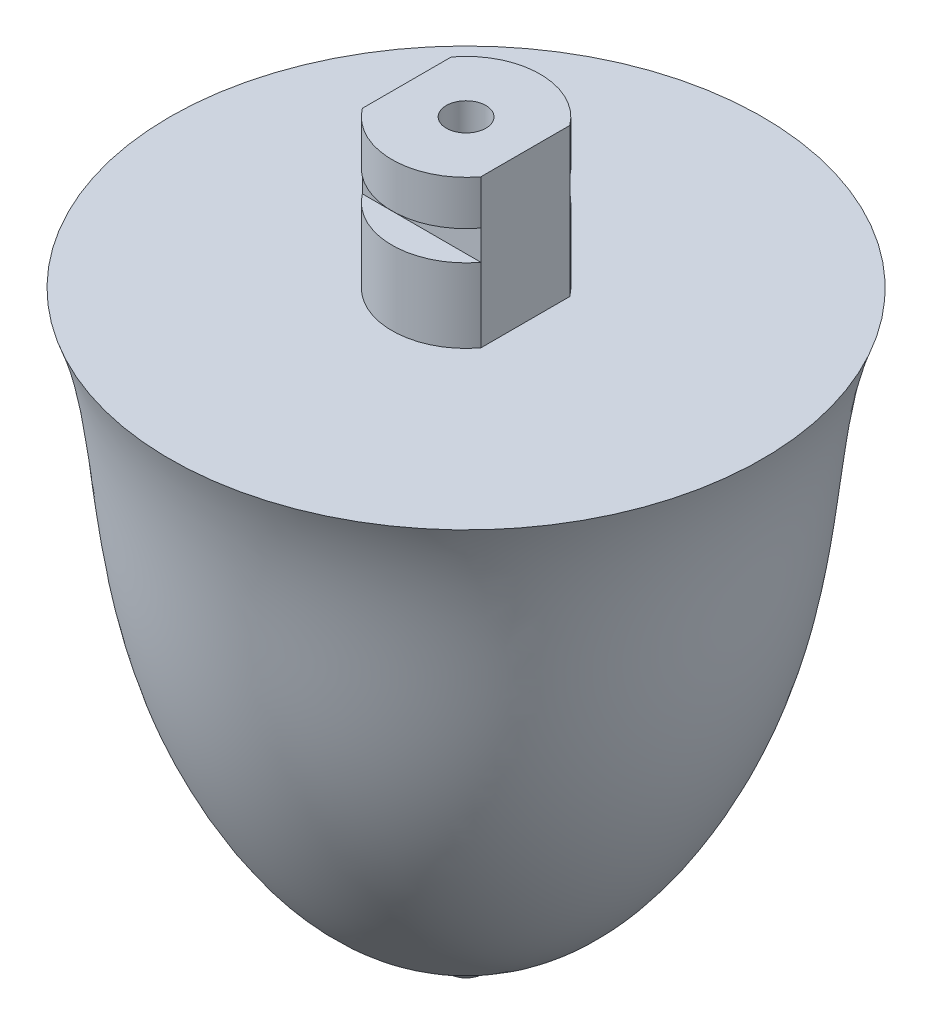
from build123d import *

# Parameters (mm, degrees)
BOSS_EXTRUDE1_DEPTH = 30
SKETCH3_R           = 4
CUT_EXTRUDE1_DEPTH  = 30
CUT_EXTRUDE2_REACH  = 152.867
SKETCH5_W           = 24
SKETCH5_H           = 6


with BuildPart() as part:
    # Sketch1 → Revolve5 (revolve)
    with BuildSketch(Plane.XY, mode=Mode.PRIVATE) as revolve5_sk:
        with BuildLine():
            Line((0, 0), (60, 0))
            add(Edge.make_bspline(
                [(13.077250629, -110), (26.441462871, -105.381596251), (58.400000122, -57.571050955), (51.598678878, -21.794632863), (60, 0)],
                knots=[0.017667594, 0.017667594, 0.017667594, 0.017667594, 0.353401106, 1, 1, 1, 1], degree=3))
            ThreePointArc((13.077250629, -110), (8.624288133, -112.501880222), (5.3315658, -116.406526078))
            ThreePointArc((5.3315658, -116.406526078), (3.082984988, -118.82225748), (0, -120))
            Line((0, -120), (0, 0))
        make_face()
    revolve(revolve5_sk.sketch.rotate(Axis((0, 0, 0), (0, -1, 0)), 180), axis=Axis((0, 0, 0), (0, -1, 0)))

    # Sketch2 → Boss-Extrude1 (add)
    with BuildSketch(Plane(origin=(0, 0, 0), x_dir=(1, 0, 0), z_dir=(0, 1, 0))):
        with BuildLine():
            Line((12, 9), (12, -9))
            ThreePointArc((12, -9), (0, -15), (-12, -9))
            Line((-12, -9), (-12, 9))
            ThreePointArc((-12, 9), (0, 15), (12, 9))
        make_face()
    extrude(amount=BOSS_EXTRUDE1_DEPTH)

    # Sketch3 → Cut-Extrude1 (cut)
    with BuildSketch(Plane(origin=(0, 30, 0), x_dir=(1, 0, 0), z_dir=(0, 1, 0))):
        with Locations(Location((0, 0, 0), (0, 0, 270))):
            Circle(SKETCH3_R)
    extrude(amount=-CUT_EXTRUDE1_DEPTH, mode=Mode.SUBTRACT)

    # Sketch5 → Cut-Extrude2 (cut, up to next)
    with BuildSketch(Plane.XY.offset(9), mode=Mode.PRIVATE) as cut_extrude2_sk1:
        with Locations((0, 18)):
            Rectangle(SKETCH5_W, SKETCH5_H)
    cut_extrude2_tool1 = extrude(cut_extrude2_sk1.sketch, amount=CUT_EXTRUDE2_REACH, mode=Mode.PRIVATE) & part.part
    cut_extrude2 = cut_extrude2_tool1.solids().sort_by_distance((0, 18, 9))[0]
    add(cut_extrude2, mode=Mode.SUBTRACT)

    # Mirror1: Cut-Extrude2 across plane
    add(cut_extrude2.mirror(Plane.XY), mode=Mode.SUBTRACT)


solid = part.part
